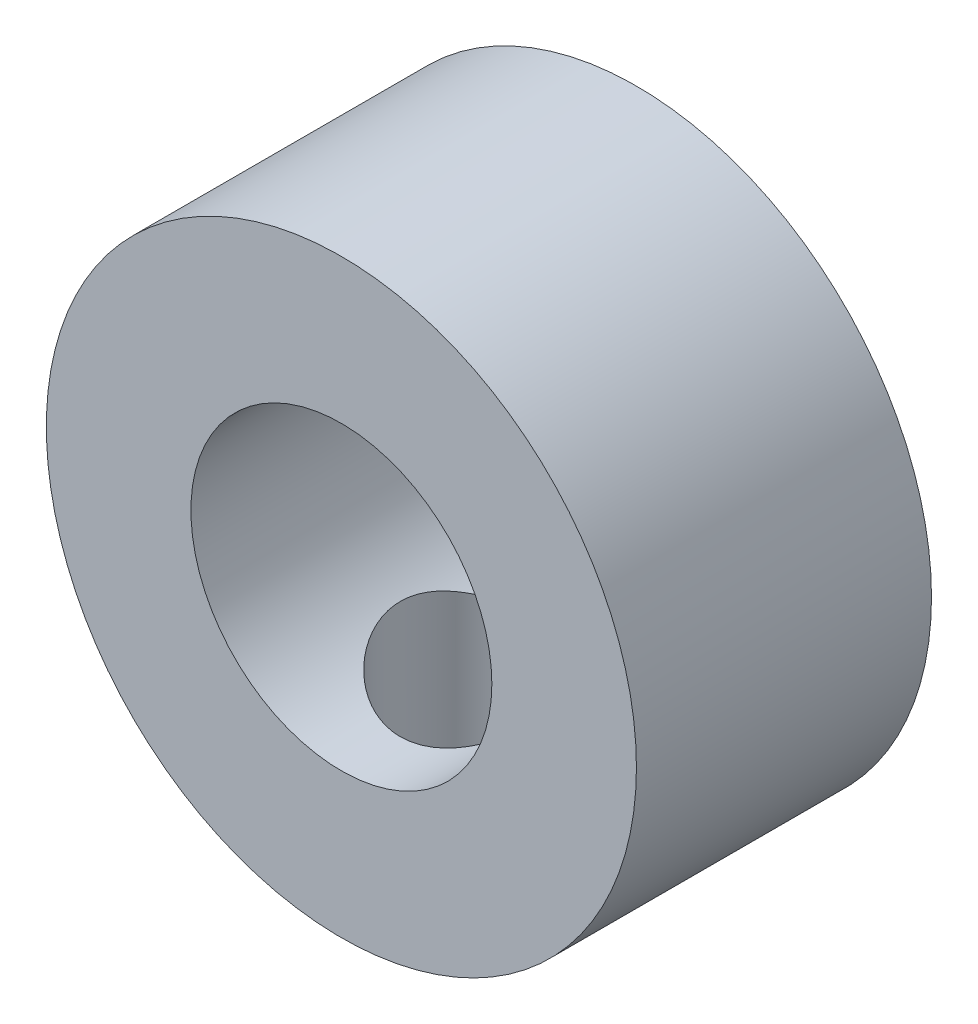
from build123d import *

# Parameters (mm, degrees)
SKETCH_1_R          = 5
SKETCH_1_R_2        = 2.55
EXTRUDE_1_DEPTH     = 5
SKETCH_2_R          = 1.5
CUT_EXTRUDE_1_DEPTH = 9.660254038


with BuildPart() as part:
    # Эскиз1 → Бобышка-Вытянуть1 (new body)
    with BuildSketch(Plane.XY):
        Circle(SKETCH_1_R)
        Circle(SKETCH_1_R_2, mode=Mode.SUBTRACT)
    extrude(amount=EXTRUDE_1_DEPTH)

    # Эскиз2 → Вырез-Вытянуть1 (cut, through all)
    with BuildSketch(Plane(origin=(0, 0, 0), x_dir=(1, 0, 0), z_dir=(0, 1, 0))):
        with Locations(Location((0, -2.5, 0), (0, 0, 270))):
            Circle(SKETCH_2_R)
    extrude(amount=-CUT_EXTRUDE_1_DEPTH, mode=Mode.SUBTRACT)


solid = part.part
